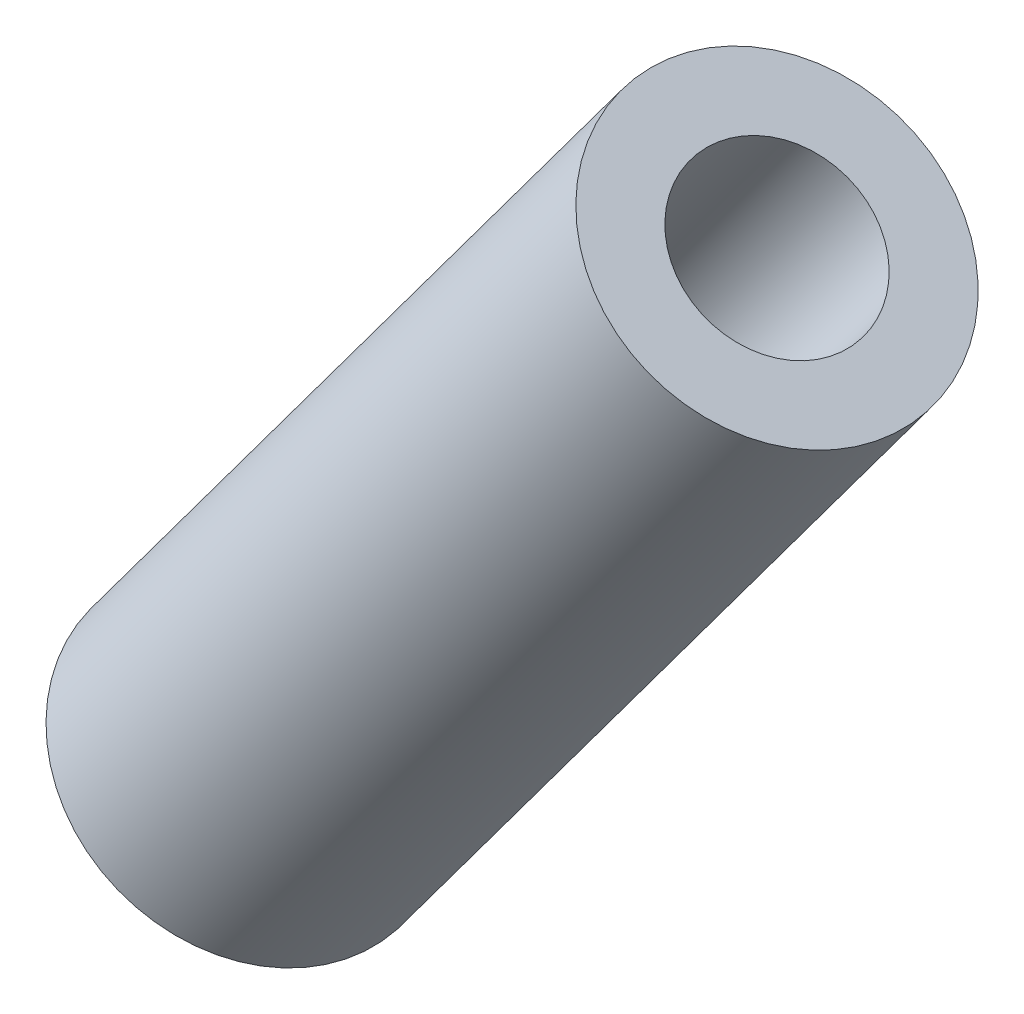
from build123d import *

# Parameters (mm, degrees)
SWEEP1_PROFILE_R     = 8.96875
CUT_SWEEP1_PROFILE_R = 5


with BuildPart() as part:
    # Sweep1: sweep along a curve in space
    with BuildLine() as sweep1_path:
        Line((0, 0, 0), (30.290133782, 40.78170908, 0))
    # Sweep1 profile (on start of the path) → Sweep1 (sweep)
    with BuildSketch(Plane(origin=(0, 0, 0), x_dir=(0.802789548818902, -0.5962624760180233, 0), z_dir=(0.5962624760180233, 0.802789548818902, 0))):
        Circle(SWEEP1_PROFILE_R)
    sweep(path=sweep1_path.line)

    # Cut-Sweep1: sweep along a curve in space
    with BuildLine() as cut_sweep1_path:
        Line((0, 0, 0), (30.290133782, 40.78170908, 0))
    # Cut-Sweep1 profile (on start of the path) → Cut-Sweep1 (sweep, cut)
    with BuildSketch(Plane(origin=(0, 0, 0), x_dir=(0.802789548818902, -0.5962624760180233, 0), z_dir=(0.5962624760180233, 0.802789548818902, 0))):
        Circle(CUT_SWEEP1_PROFILE_R)
    sweep(path=cut_sweep1_path.line, mode=Mode.SUBTRACT)


solid = part.part
